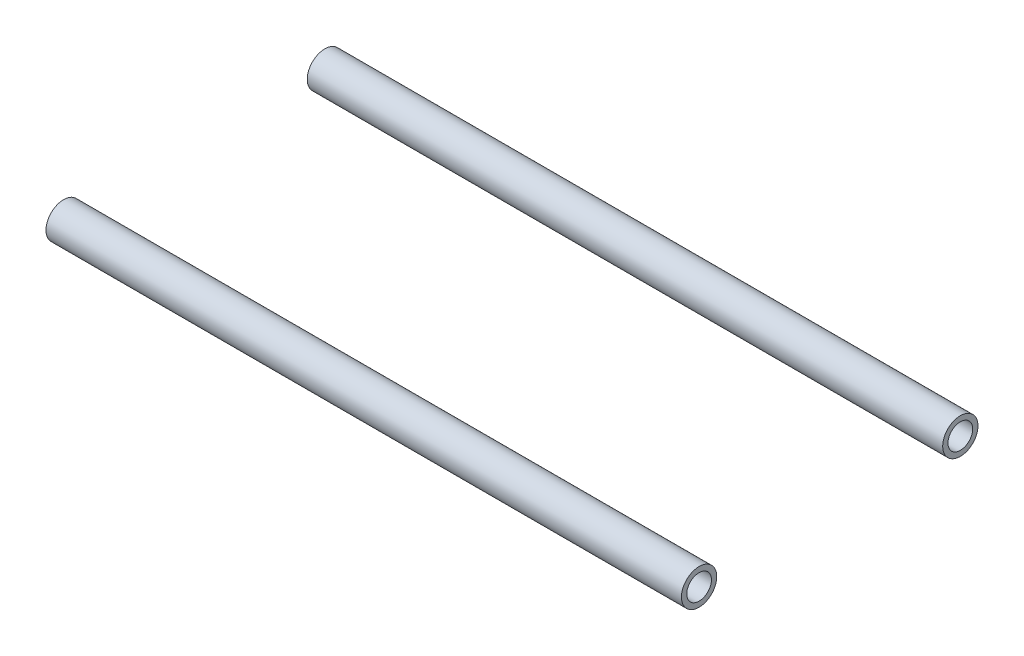
from build123d import *

# Parameters (mm, degrees)
SKETCH11_R   = 50
SKETCH11_R_2 = 35
SKETCH12_R   = 50
SKETCH12_R_2 = 35


with BuildPart() as part:
    # MemberTL: sweep along a path in Sketch7
    with BuildLine(Plane(origin=(0, 2240, 0), x_dir=(-1, 0, 0), z_dir=(0, -1, 0))) as membertl_path:
        Line((-1800, 370), (0, 370))
    # Sketch11 → MemberTL (sweep)
    with BuildSketch(Plane(origin=(0, 0, 0), x_dir=(0, 0, -1), z_dir=(1, 0, 0))):
        with Locations((370, 2240)):
            Circle(SKETCH11_R)
        with Locations((370, 2240)):
            Circle(SKETCH11_R_2, mode=Mode.SUBTRACT)
    sweep(path=membertl_path.line)


with BuildPart() as body_2:
    # MemberTR: sweep along a path in Sketch13
    with BuildLine(Plane(origin=(0, 2240, 0), x_dir=(-1, 0, 0), z_dir=(0, -1, 0))) as membertr_path:
        Line((0, -370), (-1800, -370))
    # Sketch12 → MemberTR (sweep)
    with BuildSketch(Plane(origin=(0, 0, 0), x_dir=(0, 0, -1), z_dir=(1, 0, 0))):
        with Locations((-370, 2240)):
            Circle(SKETCH12_R)
        with Locations((-370, 2240)):
            Circle(SKETCH12_R_2, mode=Mode.SUBTRACT)
    sweep(path=membertr_path.line)


solid = Compound([part.part, body_2.part])
